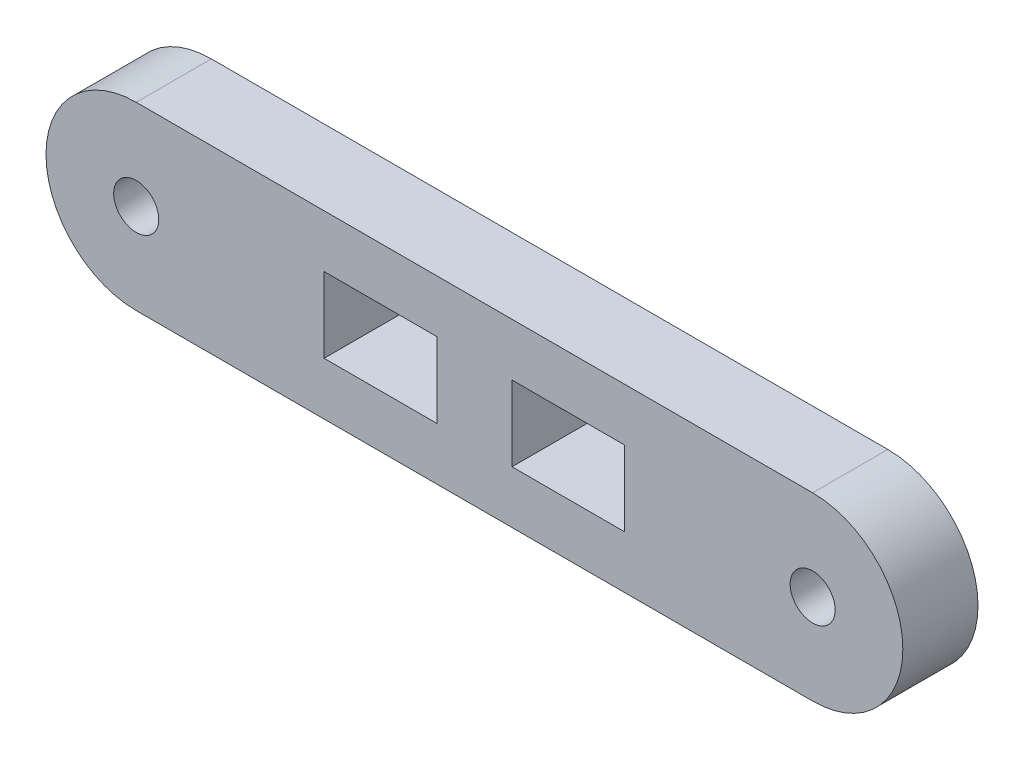
from build123d import *

# Parameters (mm, degrees)
ESQUISSE1_R        = 1.5
ESQUISSE1_W        = 7.5
ESQUISSE1_H        = 5
BOSS_EXTRU_1_DEPTH = 5


with BuildPart() as part:
    # Esquisse1 → Boss.-Extru.1 (new body)
    with BuildSketch(Plane.XY):
        with BuildLine():
            Line((0, 6), (45, 6))
            ThreePointArc((45, 6), (51, 0), (45, -6))
            Line((45, -6), (0, -6))
            ThreePointArc((0, -6), (-6, 0), (0, 6))
        make_face()
        with Locations((45, 0)):
            Circle(ESQUISSE1_R, mode=Mode.SUBTRACT)
        Circle(ESQUISSE1_R, mode=Mode.SUBTRACT)
        with Locations((28.75, 0)):
            Rectangle(ESQUISSE1_W, ESQUISSE1_H, mode=Mode.SUBTRACT)
        with Locations((16.25, 0)):
            Rectangle(ESQUISSE1_W, ESQUISSE1_H, mode=Mode.SUBTRACT)
    extrude(amount=BOSS_EXTRU_1_DEPTH)


solid = part.part
